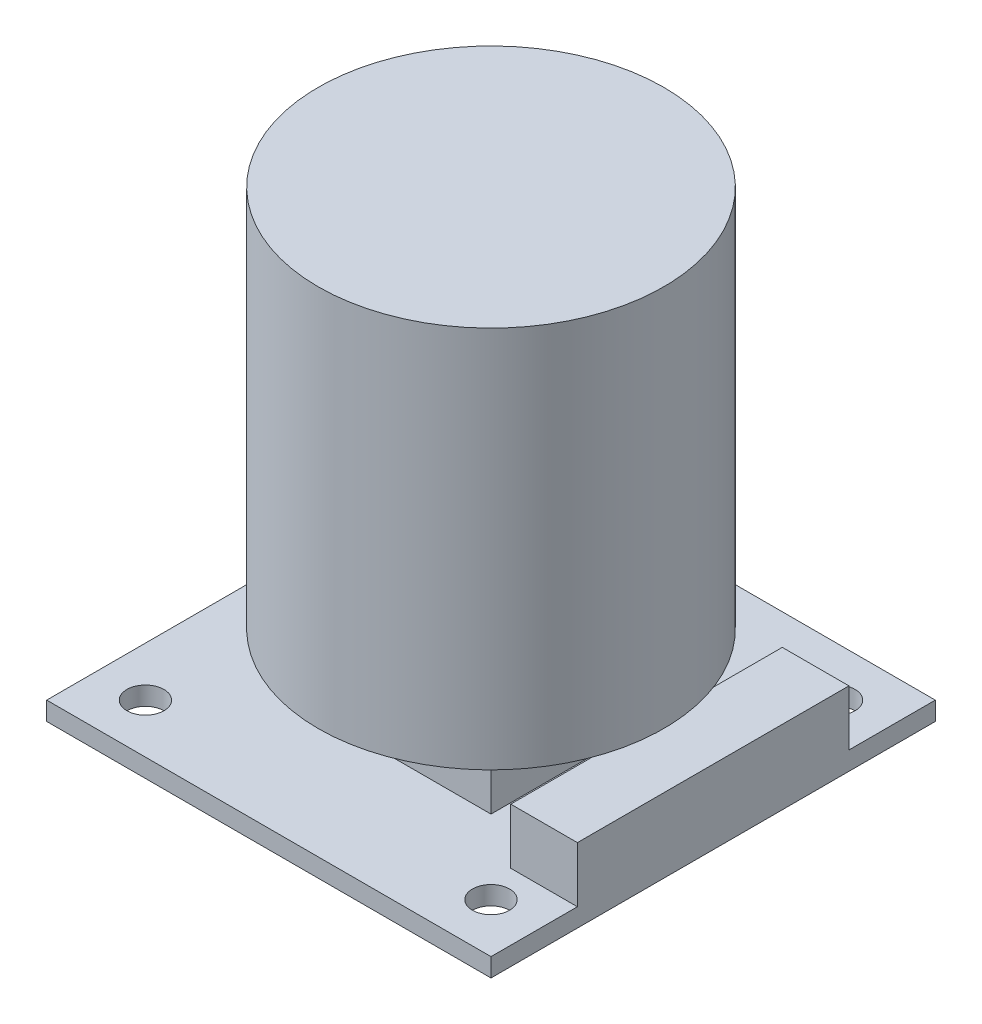
from build123d import *

# Parameters (mm, degrees)
SKETCH1_W           = 36
SKETCH1_H           = 36
BOSS_EXTRUDE1_DEPTH = 1.5
SKETCH2_R           = 1.5
CUT_EXTRUDE1_DEPTH  = 26.5
SKETCH5_W           = 5.4
SKETCH5_H           = 22
BOSS_EXTRUDE4_DEPTH = 4.5
SKETCH6_W           = 16
SKETCH6_H           = 16
BOSS_EXTRUDE5_DEPTH = 5
SKETCH7_R           = 14
BOSS_EXTRUDE6_DEPTH = 31


with BuildPart() as part:
    # Sketch1 → Boss-Extrude1 (new body)
    with BuildSketch(Plane(origin=(0, 0, 0), x_dir=(1, 0, 0), z_dir=(0, 1, 0))):
        Rectangle(SKETCH1_W, SKETCH1_H)
    extrude(amount=BOSS_EXTRUDE1_DEPTH)

    # Sketch2 → Cut-Extrude1 (cut, through all)
    with BuildSketch(Plane(origin=(0, 1.5, 0), x_dir=(1, 0, 0), z_dir=(0, 1, 0))):
        with Locations(Location((14, 14, 0), (0, 0, 270))):
            Circle(SKETCH2_R)
        with Locations(Location((14, -14, 0), (0, 0, 270))):
            Circle(SKETCH2_R)
        with Locations(Location((-14, -14, 0), (0, 0, 270))):
            Circle(SKETCH2_R)
        with Locations(Location((-14, 14, 0), (0, 0, 270))):
            Circle(SKETCH2_R)
    extrude(amount=-CUT_EXTRUDE1_DEPTH, mode=Mode.SUBTRACT)

    # Sketch5 → Boss-Extrude4 (add)
    with BuildSketch(Plane(origin=(0, 1.5, 0), x_dir=(1, 0, 0), z_dir=(0, 1, 0))):
        with Locations((15.3, 0)):
            Rectangle(SKETCH5_W, SKETCH5_H)
    extrude(amount=BOSS_EXTRUDE4_DEPTH)

    # Sketch6 → Boss-Extrude5 (add)
    with BuildSketch(Plane(origin=(0, 1.5, 0), x_dir=(1, 0, 0), z_dir=(0, 1, 0))):
        Rectangle(SKETCH6_W, SKETCH6_H)
    extrude(amount=BOSS_EXTRUDE5_DEPTH)

    # Sketch7 → Boss-Extrude6 (add)
    with BuildSketch(Plane(origin=(0, 6.5, 0), x_dir=(1, 0, 0), z_dir=(0, 1, 0))):
        with Locations(Location((0, 0, 0), (0, 0, 270))):
            Circle(SKETCH7_R)
    extrude(amount=BOSS_EXTRUDE6_DEPTH)


solid = part.part
